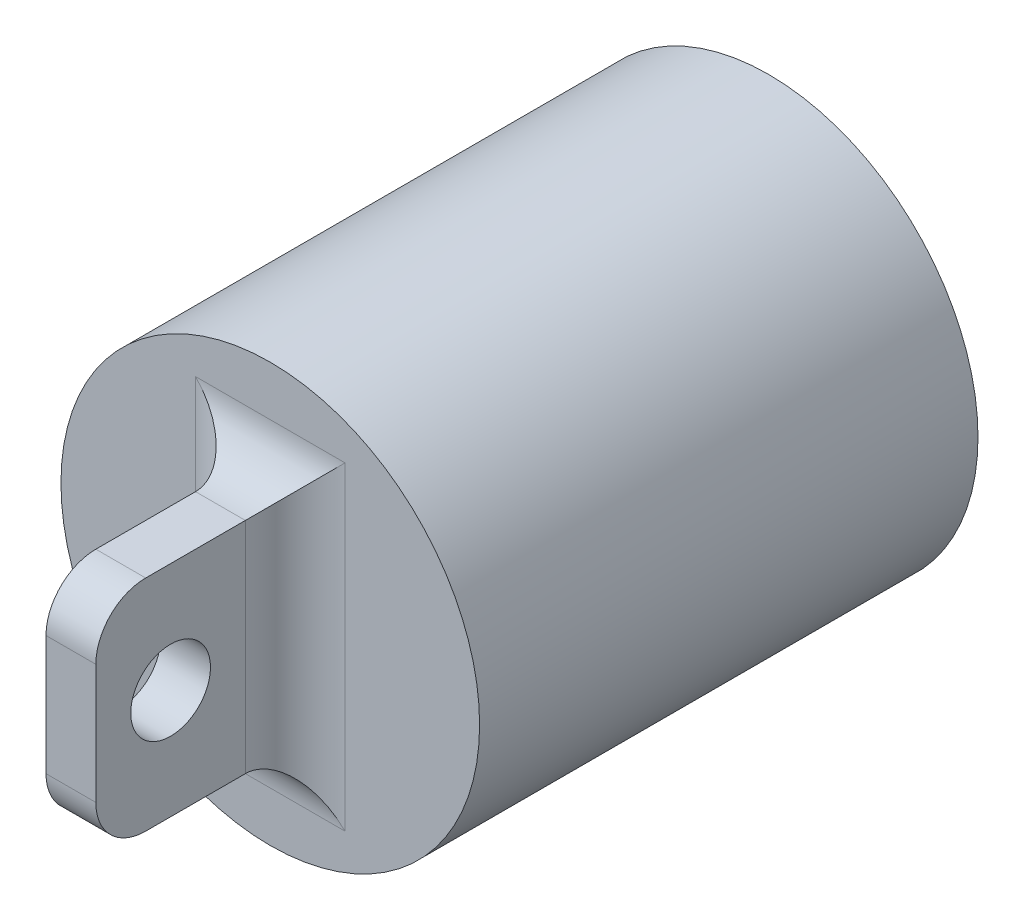
from build123d import *

# Parameters (mm, degrees)
SKETCH1_R           = 21
BOSS_EXTRUDE1_DEPTH = 50
SKETCH2_W           = 20
SKETCH2_H           = 22
BOSS_EXTRUDE2_DEPTH = 2.5
FILLET1_R           = 5
FILLET2_R           = 5
SKETCH3_R           = 4
CUT_EXTRUDE1_DEPTH  = 77.767506147


with BuildPart() as part:
    # Sketch1 → Boss-Extrude1 (new body)
    with BuildSketch(Plane.XY):
        Circle(SKETCH1_R)
    extrude(amount=BOSS_EXTRUDE1_DEPTH)

    # Sketch2 → Boss-Extrude2 (add, symmetric)
    with BuildSketch(Plane(origin=(0, 0, 0), x_dir=(0, 0, -1), z_dir=(1, 0, 0))):
        with Locations((-60, 0)):
            Rectangle(SKETCH2_W, SKETCH2_H)
    extrude(amount=BOSS_EXTRUDE2_DEPTH, both=True)

    # Fillet1
    fillet1_edges = [part.edges().sort_by_distance(p)[0] for p in [
        (-2.5, 0, 50),
        (0, -11, 50),
        (0, 11, 50),
        (2.5, 0, 50),
    ]]
    fillet(fillet1_edges, radius=FILLET1_R)

    # Fillet2
    fillet2_edges = [part.edges().sort_by_distance(p)[0] for p in [
        (0, 11, 70),
        (0, -11, 70),
    ]]
    fillet(fillet2_edges, radius=FILLET2_R)

    # Sketch3 → Cut-Extrude1 (cut, through all)
    with BuildSketch(Plane(origin=(2.5, 0, 0), x_dir=(0, 0, -1), z_dir=(1, 0, 0))):
        with Locations((-62.5, 0)):
            Circle(SKETCH3_R)
    extrude(amount=-CUT_EXTRUDE1_DEPTH, mode=Mode.SUBTRACT)


solid = part.part
